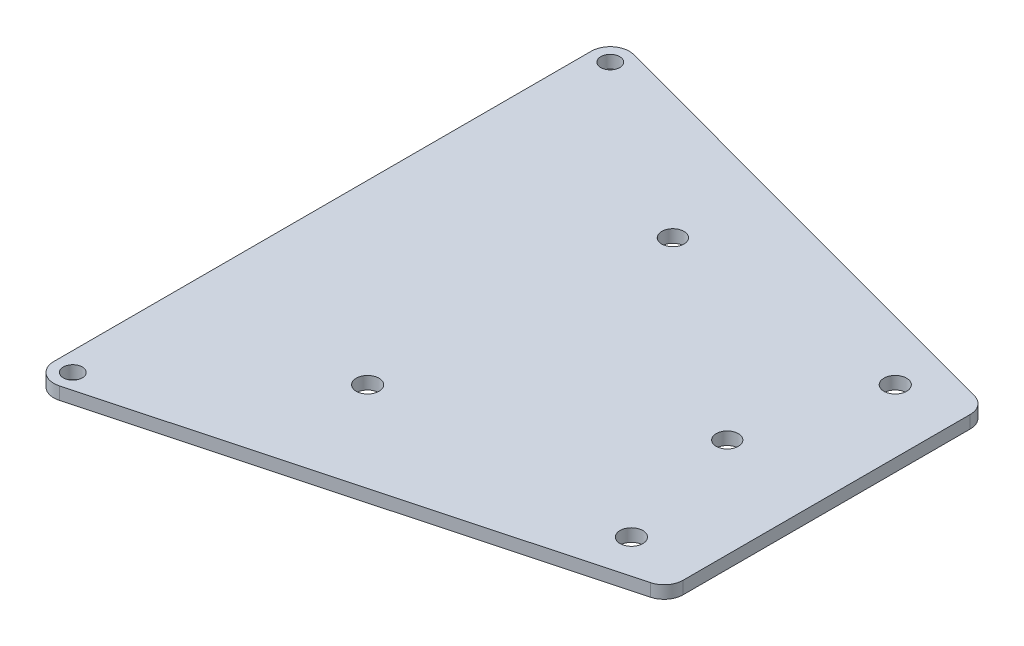
from build123d import *

# Parameters (mm, degrees)
CROQUIS1_R              = 1.8
CROQUIS1_R_2            = 1.5
CROQUIS1_R_3            = 1.75
SALIENTE_EXTRUIR1_DEPTH = 2


with BuildPart() as part:
    # Croquis1 → Saliente-Extruir1 (new body)
    with BuildSketch(Plane(origin=(0, 0, 0), x_dir=(1, 0, 0), z_dir=(0, 1, 0))):
        with BuildLine():
            Line((0.778192871, 2.897311833), (74.498192871, -16.903241843))
            ThreePointArc((74.498192871, -16.903241843), (76.10060692, -17.974982342), (76.72, -19.800553676))
            Line((76.72, -19.800553676), (76.72, -65.199446324))
            ThreePointArc((76.72, -65.199446324), (76.10060692, -67.025017658), (74.498192871, -68.096758157))
            Line((74.498192871, -68.096758157), (0.778192871, -87.897311833))
            ThreePointArc((0.778192871, -87.897311833), (-1.825571333, -87.38060692), (-3, -85))
            Line((-3, -85), (-3, 0))
            ThreePointArc((-3, 0), (-1.825571333, 2.38060692), (0.778192871, 2.897311833))
        make_face()
        with Locations(Location((25, -63.37, 0), (0, 0, 270))):
            Circle(CROQUIS1_R, mode=Mode.SUBTRACT)
        with Locations(Location((66.72, -21.65, 0), (0, 0, 270))):
            Circle(CROQUIS1_R, mode=Mode.SUBTRACT)
        with Locations(Location((66.72, -63.37, 0), (0, 0, 270))):
            Circle(CROQUIS1_R, mode=Mode.SUBTRACT)
        with Locations(Location((0, 0, 0), (0, 0, 270))):
            Circle(CROQUIS1_R_2, mode=Mode.SUBTRACT)
        with Locations(Location((0, -85, 0), (0, 0, 270))):
            Circle(CROQUIS1_R_2, mode=Mode.SUBTRACT)
        with Locations(Location((29, -19.1, 0), (0, 0, 270))):
            Circle(CROQUIS1_R_3, mode=Mode.SUBTRACT)
        with Locations(Location((61, -42.5, 0), (0, 0, 270))):
            Circle(CROQUIS1_R_3, mode=Mode.SUBTRACT)
    extrude(amount=SALIENTE_EXTRUIR1_DEPTH)


solid = part.part
